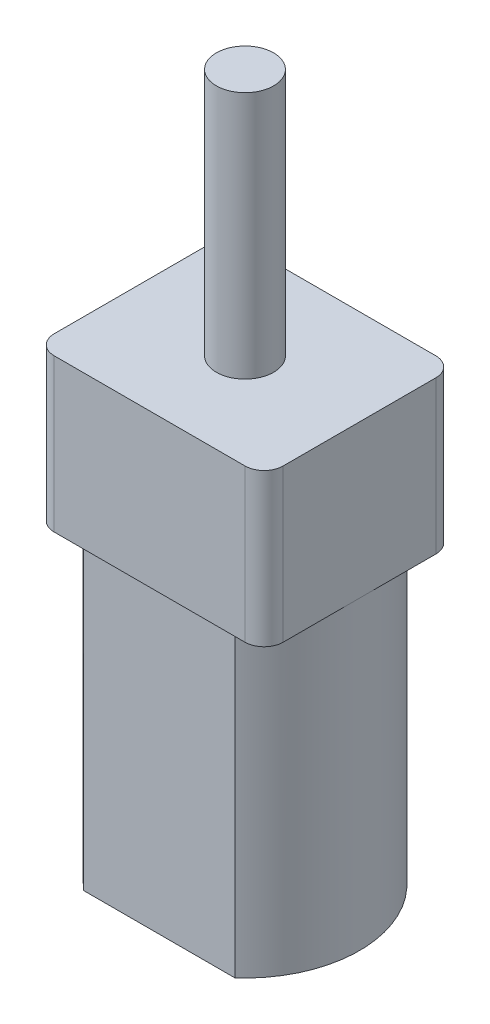
from build123d import *

# Parameters (mm, degrees)
SKETCH_1_W          = 12
SKETCH_1_H          = 10
EXTRUDE_1_DEPTH     = 24
FILLET_1_R          = 1
SKETCH_2_OUTSIDE_W  = 19.728
SKETCH_2_OUTSIDE_H  = 17.728
CUT_EXTRUDE_1_DEPTH = 16
SKETCH_3_R          = 1.5
EXTRUDE_2_DEPTH     = 13


with BuildPart() as part:
    # 草图1 → 凸台-拉伸1 (new body)
    with BuildSketch(Plane(origin=(0, 0, 0), x_dir=(1, 0, 0), z_dir=(0, 1, 0))):
        Rectangle(SKETCH_1_W, SKETCH_1_H)
    extrude(amount=EXTRUDE_1_DEPTH)

    # 圆角1
    fillet_1_edges = [part.edges().sort_by_distance(p)[0] for p in [
        (6, 12, 5),
        (-6, 12, 5),
        (-6, 12, -5),
        (6, 12, -5),
    ]]
    fillet(fillet_1_edges, radius=FILLET_1_R)

    # 草图2 outside → 切除-拉伸1 (cut)
    with BuildSketch(Plane.XZ):
        Rectangle(SKETCH_2_OUTSIDE_W, SKETCH_2_OUTSIDE_H)
        with BuildLine():
            Line((-3.968626967, -4.5), (3.968626967, -4.5))
            ThreePointArc((3.968626967, -4.5), (5.468626967, -2.468626967), (6, 0))
            ThreePointArc((6, 0), (5.468626967, 2.468626967), (3.968626967, 4.5))
            Line((3.968626967, 4.5), (-3.968626967, 4.5))
            ThreePointArc((-3.968626967, 4.5), (-5.468626967, 2.468626967), (-6, 0))
            ThreePointArc((-6, 0), (-5.468626967, -2.468626967), (-3.968626967, -4.5))
        make_face(mode=Mode.SUBTRACT)
    extrude(amount=-CUT_EXTRUDE_1_DEPTH, mode=Mode.SUBTRACT)

    # 草图3 → 凸台-拉伸2 (add)
    with BuildSketch(Plane(origin=(0, 24, 0), x_dir=(1, 0, 0), z_dir=(0, 1, 0))):
        with Locations(Location((0, 0, 0), (0, 0, 90))):
            Circle(SKETCH_3_R)
    extrude(amount=EXTRUDE_2_DEPTH)


solid = part.part
